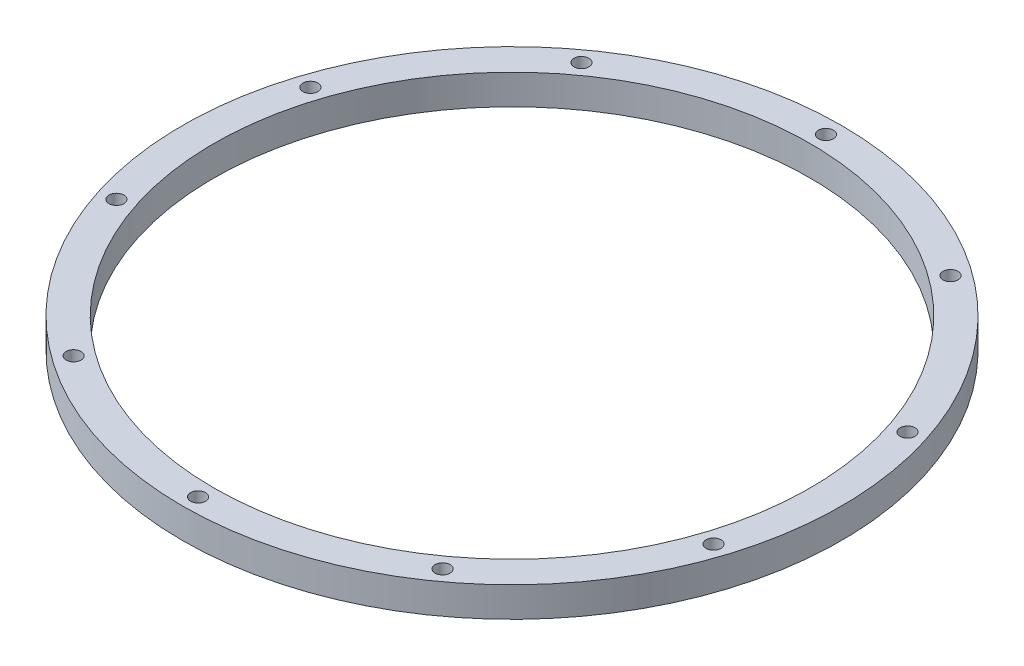
from build123d import *

# Parameters (mm, degrees)
SKETCH_1_R               = 246.95
SKETCH_1_R_2             = 223.5
EXTRUDE_5_DEPTH          = 22.45
SKETCH_1_5_R             = 5.6125
CUT_EXTRUDE_1_DEPTH      = 350.960865669
PATTERN_CIRCULAR_2_COUNT = 10


with BuildPart() as part:
    # Эскиз1 → Бобышка-Вытянуть5 (new body)
    with BuildSketch(Plane(origin=(0, 0, 0), x_dir=(1, 0, 0), z_dir=(0, 1, 0))):
        with Locations(Location((0, 0, 0), (0, 0, 270))):
            Circle(SKETCH_1_R)
        with Locations(Location((0, 0, 0), (0, 0, 270))):
            Circle(SKETCH_1_R_2, mode=Mode.SUBTRACT)
    extrude(amount=EXTRUDE_5_DEPTH)

    # Эскиз1<5> → Вырез-Вытянуть1 (cut, through all)
    with BuildSketch(Plane(origin=(0, 0, 0), x_dir=(1, 0, 0), z_dir=(0, 1, 0))):
        with Locations(Location((0, -235.225, 0), (0, 0, 270))):
            Circle(SKETCH_1_5_R)
    cut_extrude_1 = extrude(amount=CUT_EXTRUDE_1_DEPTH, mode=Mode.SUBTRACT)

    # Круговой массив2: Вырез-Вытянуть1 ×10 about axis
    pattern_circular_2_axis = Axis((0, 0, 0), (0, 1, 0))
    for i in range(1, PATTERN_CIRCULAR_2_COUNT):
        add(cut_extrude_1.rotate(pattern_circular_2_axis, i * 360 / PATTERN_CIRCULAR_2_COUNT), mode=Mode.SUBTRACT)


solid = part.part
